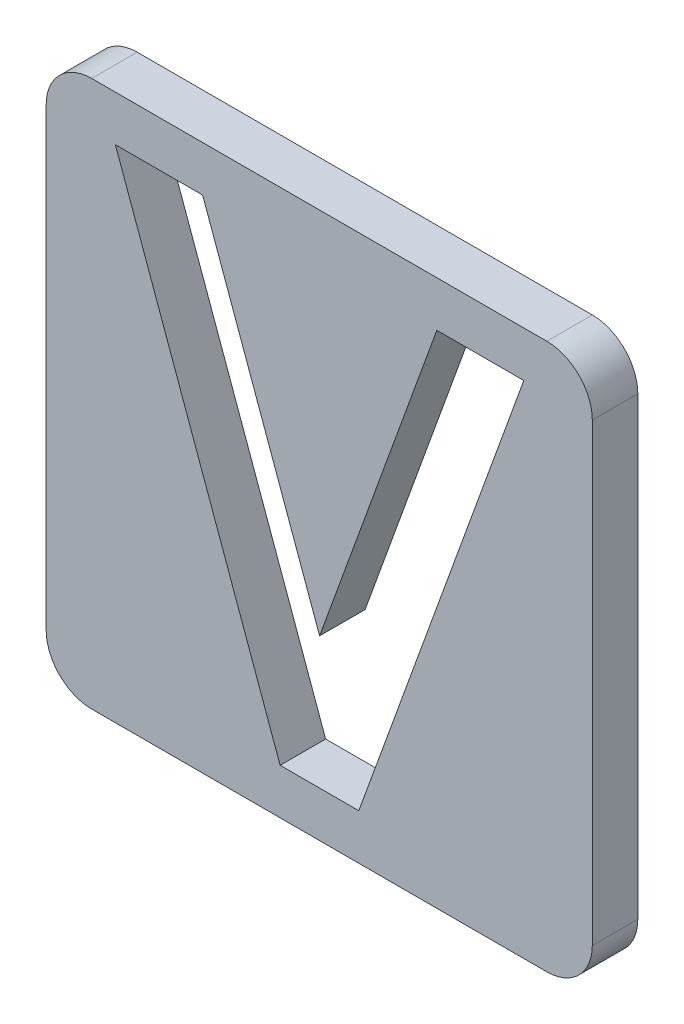
from build123d import *

# Parameters (mm, degrees)
BOSS_EXTRUDE1_DEPTH = 10
CUT_EXTRUDE35_DEPTH = 10


with BuildPart() as part:
    # Sketch1 → Boss-Extrude1 (new body)
    with BuildSketch(Plane.XY):
        with BuildLine():
            Line((-50, 60), (50, 60))
            ThreePointArc((50, 60), (57.071067812, 57.071067812), (60, 50))
            Line((60, 50), (60, -50))
            ThreePointArc((60, -50), (57.071067812, -57.071067812), (50, -60))
            Line((50, -60), (-50, -60))
            ThreePointArc((-50, -60), (-57.071067812, -57.071067812), (-60, -50))
            Line((-60, -50), (-60, 50))
            ThreePointArc((-60, 50), (-57.071067812, 57.071067812), (-50, 60))
        make_face()
    extrude(amount=BOSS_EXTRUDE1_DEPTH)

    # Sketch2 → Cut-Extrude35 (cut)
    with BuildSketch(Plane.XY.offset(10)):
        Polygon((-44.794871795, 50), (-25.624198718, 50), (0.076923077, -21.033653846), (25.838141026, 50), (44.948717949, 50), (8.690705128, -50), (-8.596955128, -50), align=None)
    extrude(amount=-CUT_EXTRUDE35_DEPTH, mode=Mode.SUBTRACT)


solid = part.part
